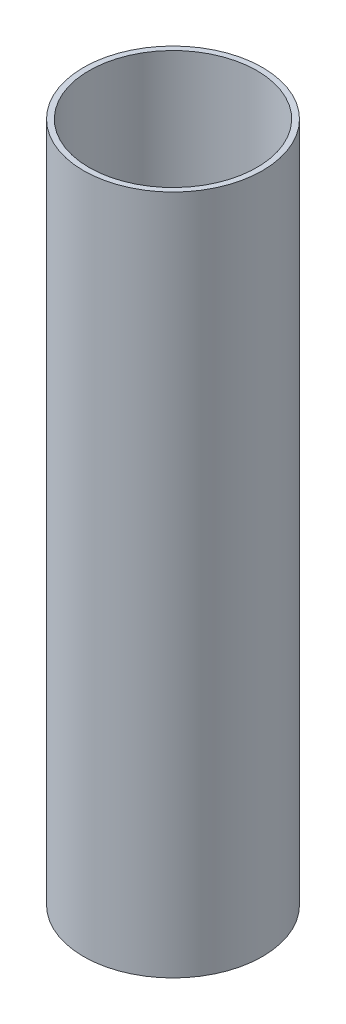
from build123d import *

# Parameters (mm, degrees)
SKETCH_6_W          = 9.2
SKETCH_6_H          = 70
SKETCH_9_R          = 8.632237887
CUT_EXTRUDE_1_DEPTH = 72.198876396


with BuildPart() as part:
    # 草图6 → 旋转2 (revolve)
    with BuildSketch(Plane(origin=(0, 0, 0), x_dir=(0, 0, -1), z_dir=(1, 0, 0)), mode=Mode.PRIVATE) as revolve_2_sk:
        with Locations((4.6, -35)):
            Rectangle(SKETCH_6_W, SKETCH_6_H)
    revolve(revolve_2_sk.sketch.rotate(Axis((0, 0, 0), (0, -1, 0)), 180), axis=Axis((0, 0, 0), (0, -1, 0)))

    # 草图9 → 切除-拉伸1 (cut, through all)
    with BuildSketch(Plane(origin=(0, 0, 0), x_dir=(1, 0, 0), z_dir=(0, 1, 0))):
        with Locations(Location((0, 0, 0), (0, 0, 270))):
            Circle(SKETCH_9_R)
    extrude(amount=-CUT_EXTRUDE_1_DEPTH, mode=Mode.SUBTRACT)


solid = part.part
